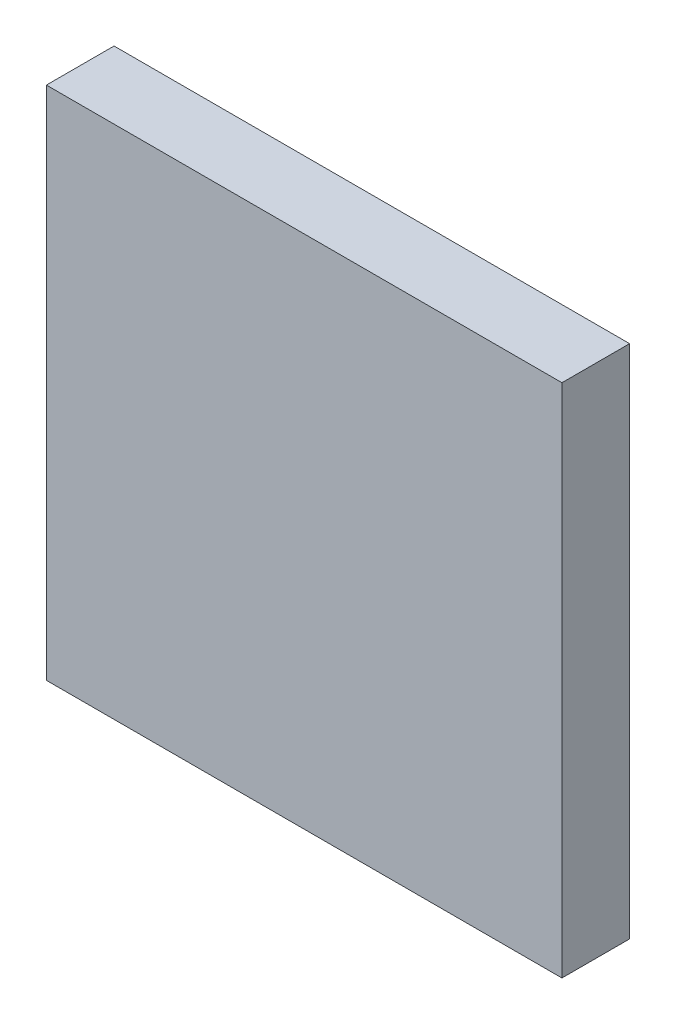
from build123d import *

# Parameters (mm, degrees)
SKETCH1_R           = 7.5
BOSS_EXTRUDE1_DEPTH = 22
SKETCH2_R           = 10
BOSS_EXTRUDE2_DEPTH = 3
SKETCH3_W           = 76.2
SKETCH3_H           = 76.2
BOSS_EXTRUDE3_DEPTH = 10


with BuildPart() as part:
    # Sketch1 → Boss-Extrude1 (new body)
    with BuildSketch(Plane.XY):
        Circle(SKETCH1_R)
    extrude(amount=-BOSS_EXTRUDE1_DEPTH)

    # Sketch2 → Boss-Extrude2 (add)
    with BuildSketch(Plane.XY):
        with Locations(Location((0, 0, 0), (0, 0, 90))):
            Circle(SKETCH2_R)
    extrude(amount=BOSS_EXTRUDE2_DEPTH)

    # Sketch3 → Boss-Extrude3 (add)
    with BuildSketch(Plane.XY.offset(3)):
        Rectangle(SKETCH3_W, SKETCH3_H)
    extrude(amount=BOSS_EXTRUDE3_DEPTH)


solid = part.part
